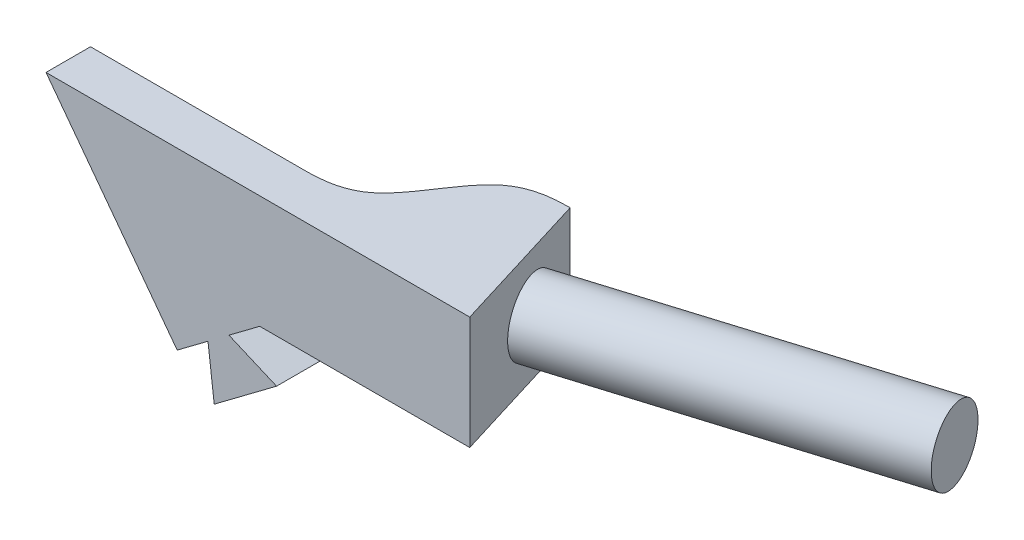
from build123d import *

# Parameters (mm, degrees)
BOSS_EXTRUDE1_DEPTH      = 12.7
BOSS_EXTRUDE1_DEPTH_BACK = 19.878167
SKETCH1_W                = 76.2
SKETCH1_H                = 25.4
CUT_EXTRUDE1_DEPTH       = 50.919049703
SKETCH4_R                = 7.9375
BOSS_EXTRUDE2_DEPTH      = 76.2
BOSS_EXTRUDE3_DEPTH      = 10


with BuildPart() as part:
    # Sketch1 → Boss-Extrude1 (new, two sides: drawn at the far end of the back side and taken through both)
    with BuildSketch(Plane.XY.offset(-BOSS_EXTRUDE1_DEPTH_BACK)):
        Rectangle(SKETCH1_W, SKETCH1_H)
    extrude(amount=BOSS_EXTRUDE1_DEPTH + BOSS_EXTRUDE1_DEPTH_BACK)

    # Sketch2 → Cut-Extrude1 (cut, through all)
    with BuildSketch(Plane.XZ.offset(12.7)):
        Polygon((33.097822487, -3.5890835), (28.095644974, -19.878167), (30.299971912, -19.878167), (38.1, -19.878167), (38.1, -5.125190787), align=None)
        Polygon((38.1, 12.7), (33.097822487, -3.5890835), (38.1, -5.125190787), align=None)
        with BuildLine():
            Line((28.095644974, -19.878167), (-38.1, -19.878167))
            Line((-38.1, -19.878167), (-38.1, 2.7))
            Line((-38.1, 2.7), (-9.105646135, 2.7))
            add(Edge.make_bspline(
                [(28.095644974, -19.878167), (23.262476233, -19.878167), (13.759725723, -18.38827049), (5.19295176, 1.21010349), (-4.185142014, 2.7), (-9.105646135, 2.7)],
                knots=[0, 0, 0, 0, 0.311689084, 0.688310916, 1, 1, 1, 1], degree=3))
        make_face()
    extrude(amount=-CUT_EXTRUDE1_DEPTH, mode=Mode.SUBTRACT)

    # Sketch4 → Boss-Extrude2 (add)
    with BuildSketch(Plane(origin=(31.252760971, 0, -9.59733911), x_dir=(-0.2935578385035089, 0, -0.95594131381228), z_dir=(0.95594131381228, 0, -0.2935578385035089))):
        with Locations((-2.530674188, 0)):
            Circle(SKETCH4_R)
    extrude(amount=BOSS_EXTRUDE2_DEPTH)

    # Sketch5 → Boss-Extrude3 (add)
    with BuildSketch(Plane(origin=(0, 0, 2.7), x_dir=(-1, 0, 0), z_dir=(0, 0, -1))):
        Polygon((38.1, 12.7), (38.1, -12.7), (57.150604496, 12.7), align=None)
        Polygon((27.661608652, -26.617413502), (38.1, -12.7), (9.105646135, -12.7), (16.030761987, -17.894001701), (5.322904607, -22.467747821), (19.34354444, -32.983561373), (20.7364928, -21.423411802), align=None)
    extrude(amount=-BOSS_EXTRUDE3_DEPTH)


solid = part.part
